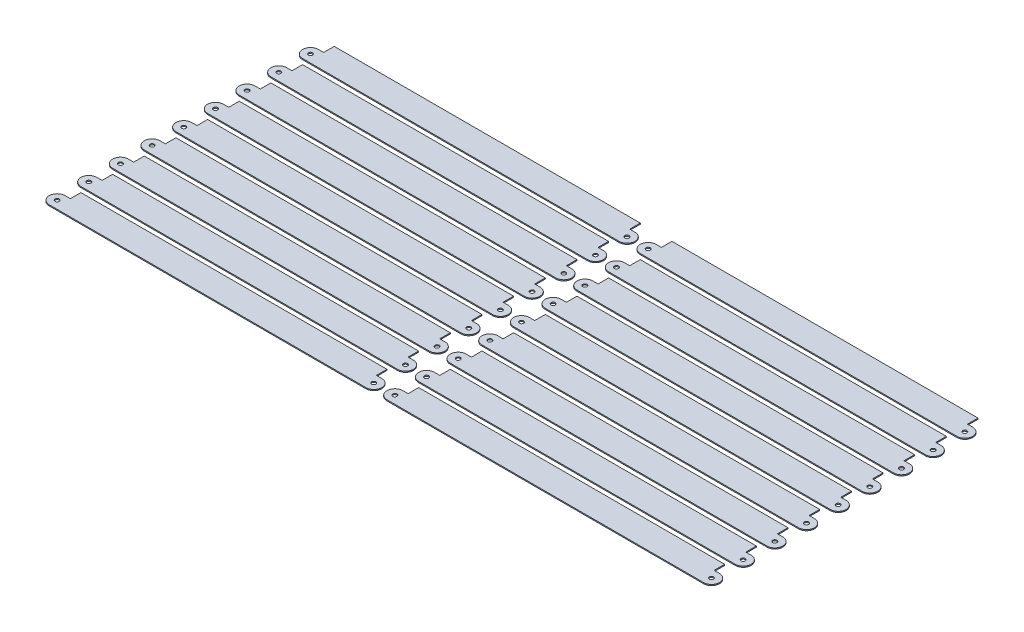
from build123d import *

# Parameters (mm, degrees)
SKETCH1_R           = 2
BOSS_EXTRUDE1_DEPTH = 1
LPATTERN1_COUNT     = 9
LPATTERN1_PITCH     = 30
LPATTERN1_2_COUNT   = 2
LPATTERN1_2_PITCH   = 320


with BuildPart() as part:
    # Sketch1 → Boss-Extrude1 (new body)
    with BuildSketch(Plane(origin=(0, 0, 0), x_dir=(1, 0, 0), z_dir=(0, 1, 0))):
        with BuildLine():
            Line((0, 7.5), (5, 7.5))
            Line((5, 7.5), (5, 17.5))
            Line((5, 17.5), (295, 17.5))
            Line((295, 17.5), (295, 7.5))
            Line((295, 7.5), (300, 7.5))
            ThreePointArc((300, 7.5), (304.937104415, 5.645794895), (307.433034374, 1))
            Line((307.433034374, 1), (307.5, 1))
            Line((307.5, 1), (307.5, -1))
            Line((307.5, -1), (307.433034374, -1))
            ThreePointArc((307.433034374, -1), (304.937104415, -5.645794895), (300, -7.5))
            Line((300, -7.5), (0, -7.5))
            ThreePointArc((0, -7.5), (-4.937104415, -5.645794895), (-7.433034374, -1))
            Line((-7.433034374, -1), (-7.5, -1))
            Line((-7.5, -1), (-7.5, 1))
            Line((-7.5, 1), (-7.433034374, 1))
            ThreePointArc((-7.433034374, 1), (-4.937104415, 5.645794895), (0, 7.5))
        make_face()
        with Locations(Location((0, 0, 0), (0, 0, 270))):
            Circle(SKETCH1_R, mode=Mode.SUBTRACT)
        with Locations(Location((300, 0, 0), (0, 0, 270))):
            Circle(SKETCH1_R, mode=Mode.SUBTRACT)
    extrude(amount=BOSS_EXTRUDE1_DEPTH)


with BuildPart() as lpattern1_1:
    # LPattern1: pattern copy
    add(part.part.moved(Location(Vector(0, 0, -1) * (1 * LPATTERN1_PITCH))))


with BuildPart() as lpattern1_2:
    # LPattern1: pattern copy
    add(part.part.moved(Location(Vector(0, 0, -1) * (2 * LPATTERN1_PITCH))))


with BuildPart() as lpattern1_3:
    # LPattern1: pattern copy
    add(part.part.moved(Location(Vector(0, 0, -1) * (3 * LPATTERN1_PITCH))))


with BuildPart() as lpattern1_4:
    # LPattern1: pattern copy
    add(part.part.moved(Location(Vector(0, 0, -1) * (4 * LPATTERN1_PITCH))))


with BuildPart() as lpattern1_5:
    # LPattern1: pattern copy
    add(part.part.moved(Location(Vector(0, 0, -1) * (5 * LPATTERN1_PITCH))))


with BuildPart() as lpattern1_6:
    # LPattern1: pattern copy
    add(part.part.moved(Location(Vector(0, 0, -1) * (6 * LPATTERN1_PITCH))))


with BuildPart() as lpattern1_7:
    # LPattern1: pattern copy
    add(part.part.moved(Location(Vector(0, 0, -1) * (7 * LPATTERN1_PITCH))))


with BuildPart() as lpattern1_8:
    # LPattern1: pattern copy
    add(part.part.moved(Location(Vector(0, 0, -1) * (8 * LPATTERN1_PITCH))))


with BuildPart() as lpattern1_2_1:
    # LPattern1 2: pattern copy
    add(part.part.moved(Location(Vector(1, 0, 0) * (1 * LPATTERN1_2_PITCH))))


with BuildPart() as lpattern1_2_2:
    # LPattern1 2: pattern copy
    add(lpattern1_1.part.moved(Location(Vector(1, 0, 0) * (1 * LPATTERN1_2_PITCH))))


with BuildPart() as lpattern1_2_3:
    # LPattern1 2: pattern copy
    add(lpattern1_2.part.moved(Location(Vector(1, 0, 0) * (1 * LPATTERN1_2_PITCH))))


with BuildPart() as lpattern1_2_4:
    # LPattern1 2: pattern copy
    add(lpattern1_3.part.moved(Location(Vector(1, 0, 0) * (1 * LPATTERN1_2_PITCH))))


with BuildPart() as lpattern1_2_5:
    # LPattern1 2: pattern copy
    add(lpattern1_4.part.moved(Location(Vector(1, 0, 0) * (1 * LPATTERN1_2_PITCH))))


with BuildPart() as lpattern1_2_6:
    # LPattern1 2: pattern copy
    add(lpattern1_5.part.moved(Location(Vector(1, 0, 0) * (1 * LPATTERN1_2_PITCH))))


with BuildPart() as lpattern1_2_7:
    # LPattern1 2: pattern copy
    add(lpattern1_6.part.moved(Location(Vector(1, 0, 0) * (1 * LPATTERN1_2_PITCH))))


with BuildPart() as lpattern1_2_8:
    # LPattern1 2: pattern copy
    add(lpattern1_7.part.moved(Location(Vector(1, 0, 0) * (1 * LPATTERN1_2_PITCH))))


with BuildPart() as lpattern1_2_9:
    # LPattern1 2: pattern copy
    add(lpattern1_8.part.moved(Location(Vector(1, 0, 0) * (1 * LPATTERN1_2_PITCH))))


solid = Compound([part.part, lpattern1_1.part, lpattern1_2.part, lpattern1_3.part, lpattern1_4.part, lpattern1_5.part, lpattern1_6.part, lpattern1_7.part, lpattern1_8.part, lpattern1_2_1.part, lpattern1_2_2.part, lpattern1_2_3.part, lpattern1_2_4.part, lpattern1_2_5.part, lpattern1_2_6.part, lpattern1_2_7.part, lpattern1_2_8.part, lpattern1_2_9.part])
